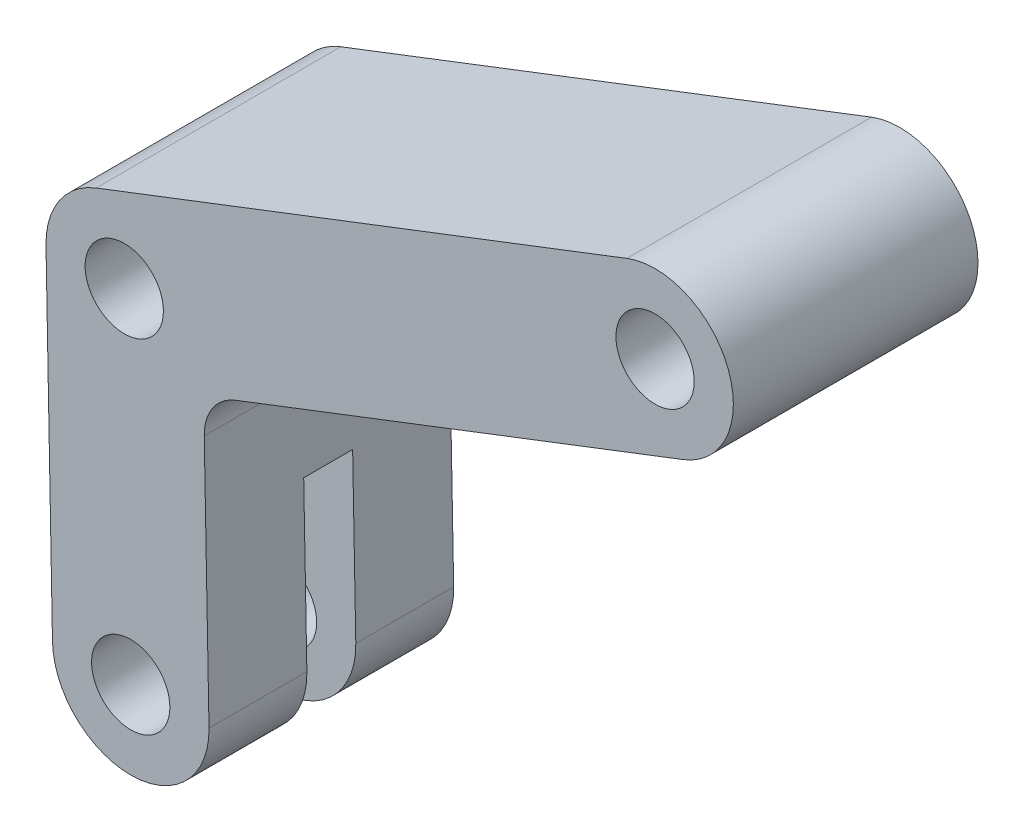
from build123d import *

# Parameters (mm, degrees)
SKETCH1_R               = 4
BOSS_EXTRUDE1_DEPTH     = 25
FILLET1_R               = 5
CUT_EXTRUDE1_DEPTH      = 98.629965424
CUT_EXTRUDE1_DEPTH_BACK = 98.629965424
SKETCH2_W               = 5
SKETCH2_H               = 30


with BuildPart() as part:
    # Sketch1 → Boss-Extrude1 (new body)
    with BuildSketch(Plane.XY):
        with BuildLine():
            ThreePointArc((56.45524489, 48.144548452), (61.045451548, 58.48524489), (50.70475511, 63.075451548))
            Line((50.70475511, 63.075451548), (-3.53524489, 42.185451548))
            ThreePointArc((-3.53524489, 42.185451548), (-7.298349786, 39.184561806), (-8.658548629, 34.567619439))
            Line((-8.658548629, 34.567619439), (-8, 0))
            ThreePointArc((-8, 0), (0.076026565, -7.999638739), (7.99855499, 0.152046264))
            Line((7.99855499, 0.152046264), (7.445069005, 29.268763528))
            Line((7.445069005, 29.268763528), (56.45524489, 48.144548452))
        make_face()
        Circle(SKETCH1_R, mode=Mode.SUBTRACT)
        with Locations((-0.66, 34.72)):
            Circle(SKETCH1_R, mode=Mode.SUBTRACT)
        with Locations((53.58, 55.61)):
            Circle(SKETCH1_R, mode=Mode.SUBTRACT)
    extrude(amount=-BOSS_EXTRUDE1_DEPTH)

    # Fillet1
    fillet1_edges = [part.edges().sort_by_distance(p)[0] for p in [
        (7.445069005, 29.268763528, -12.5),
    ]]
    fillet(fillet1_edges, radius=FILLET1_R)

    # Sketch2 → Cut-Extrude1 (cut, two sides: drawn at the far end of the back side and taken through both)
    with BuildSketch(Plane(origin=(-7.997097521, -0.152352916, 0), x_dir=(0, 0, 1), z_dir=(-0.9998185785801337, -0.019047570081273786, 0)).offset(-CUT_EXTRUDE1_DEPTH_BACK)):
        with Locations((-12.5, 2)):
            Rectangle(SKETCH2_W, SKETCH2_H)
    extrude(amount=CUT_EXTRUDE1_DEPTH + CUT_EXTRUDE1_DEPTH_BACK, mode=Mode.SUBTRACT)


solid = part.part
